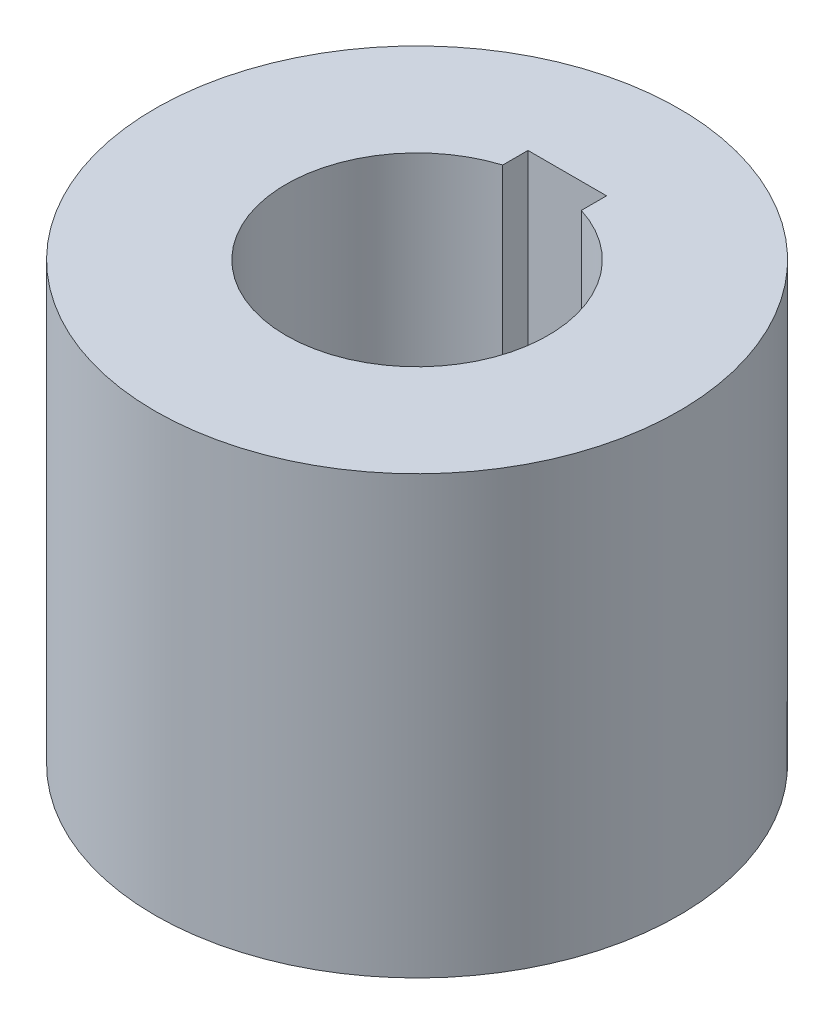
from build123d import *

# Parameters (mm, degrees)
SKETCH2_R           = 60
BOSS_EXTRUDE1_DEPTH = 100
SKETCH3_R           = 30
CUT_EXTRUDE1_DEPTH  = 132.148770486
SKETCH4_W           = 18
SKETCH4_H           = 11
CUT_EXTRUDE2_DEPTH  = 132.148770486


with BuildPart() as part:
    # Sketch2 → Boss-Extrude1 (new body)
    with BuildSketch(Plane(origin=(0, 0, 0), x_dir=(1, 0, 0), z_dir=(0, 1, 0))):
        with Locations(Location((0, 0, 0), (0, 0, 270))):
            Circle(SKETCH2_R)
    extrude(amount=BOSS_EXTRUDE1_DEPTH)

    # Sketch3 → Cut-Extrude1 (cut, through all)
    with BuildSketch(Plane(origin=(0, 100, 0), x_dir=(1, 0, 0), z_dir=(0, 1, 0))):
        with Locations(Location((0, 0, 0), (0, 0, 270))):
            Circle(SKETCH3_R)
    extrude(amount=-CUT_EXTRUDE1_DEPTH, mode=Mode.SUBTRACT)

    # Sketch4 → Cut-Extrude2 (cut, through all)
    with BuildSketch(Plane(origin=(0, 100, 0), x_dir=(1, 0, 0), z_dir=(0, 1, 0))):
        with Locations((0, 28.9)):
            Rectangle(SKETCH4_W, SKETCH4_H)
    extrude(amount=-CUT_EXTRUDE2_DEPTH, mode=Mode.SUBTRACT)


solid = part.part
